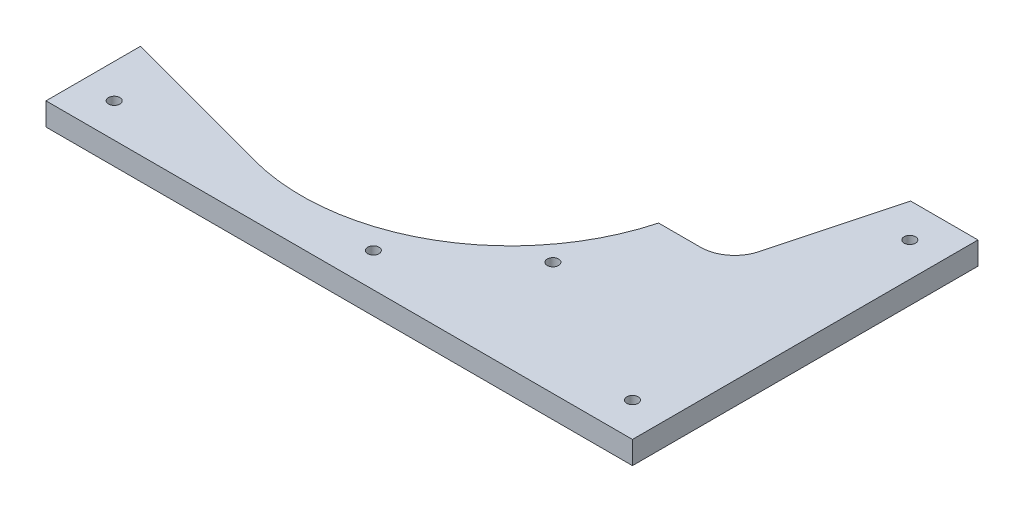
from build123d import *

# Parameters (mm, degrees)
SKETCH1_R           = 3.175
BOSS_EXTRUDE1_DEPTH = 12.7
FILLET1_R           = 19.05


with BuildPart() as part:
    # Sketch1 → Boss-Extrude1 (new body)
    with BuildSketch(Plane(origin=(0, 0, 0), x_dir=(1, 0, 0), z_dir=(0, 1, 0))):
        with BuildLine():
            ThreePointArc((0, 0), (71.127685365, 24.14459572), (112.858773544, 86.59958277))
            Line((112.858773544, 86.59958277), (150.958773544, 86.59958277))
            Line((150.958773544, 86.59958277), (172.673487895, 167.64))
            Line((172.673487895, 167.64), (210.27435392, 167.64))
            Line((210.27435392, 167.64), (210.27435392, -25.4))
            Line((210.27435392, -25.4), (0, -25.4))
            Line((0, -25.4), (-117.38564608, -25.4))
            Line((-117.38564608, -25.4), (-117.38564608, 27.331720151))
            Line((-117.38564608, 27.331720151), (-30.24041723, 3.981226456))
            ThreePointArc((-30.24041723, 3.981226456), (-15.250680299, 0.999582397), (0, 0))
        make_face()
        with Locations(Location((191.22435392, -6.35, 0), (0, 0, 270))):
            Circle(SKETCH1_R, mode=Mode.SUBTRACT)
        with Locations(Location((191.22435392, 148.59, 0), (0, 0, 270))):
            Circle(SKETCH1_R, mode=Mode.SUBTRACT)
        with Locations(Location((102.32435392, 38.1, 0), (0, 0, 270))):
            Circle(SKETCH1_R, mode=Mode.SUBTRACT)
        with Locations(Location((46.44435392, -6.35, 0), (0, 0, 270))):
            Circle(SKETCH1_R, mode=Mode.SUBTRACT)
        with Locations(Location((-98.33564608, -6.35, 0), (0, 0, 270))):
            Circle(SKETCH1_R, mode=Mode.SUBTRACT)
    extrude(amount=BOSS_EXTRUDE1_DEPTH)

    # Fillet1
    fillet1_edges = [part.edges().sort_by_distance(p)[0] for p in [
        (150.958773544, 6.35, -86.59958277),
    ]]
    fillet(fillet1_edges, radius=FILLET1_R)


solid = part.part
